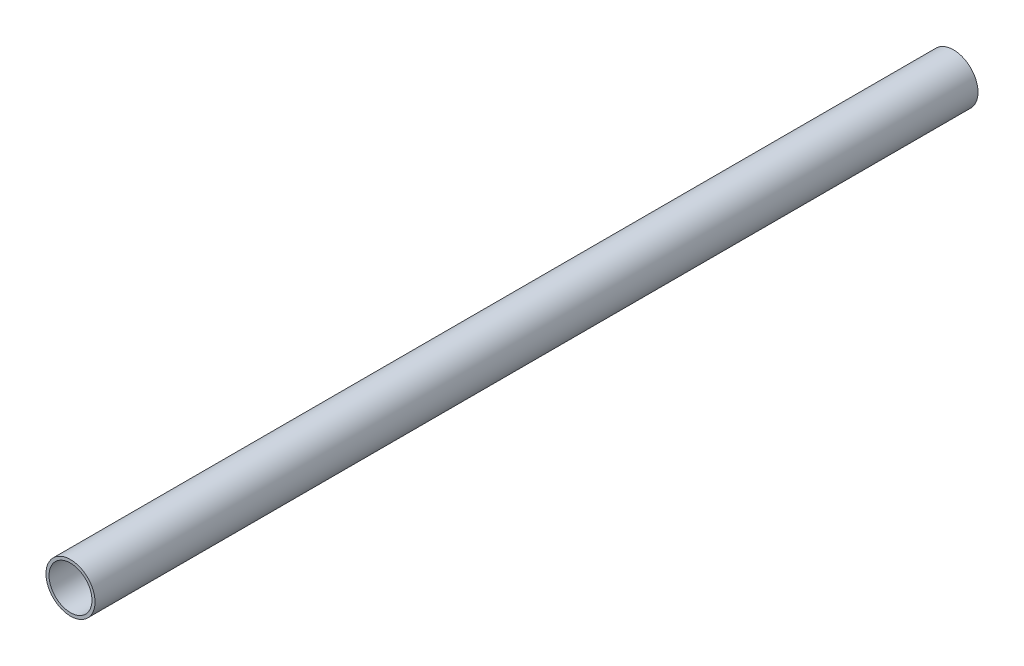
from build123d import *

# Parameters (mm, degrees)
SKETCH1_R           = 12.7
SKETCH1_R_2         = 11.1125
BOSS_EXTRUDE1_DEPTH = 457.2


with BuildPart() as part:
    # Sketch1 → Boss-Extrude1 (new body)
    with BuildSketch(Plane.XY):
        Circle(SKETCH1_R)
        Circle(SKETCH1_R_2, mode=Mode.SUBTRACT)
    extrude(amount=BOSS_EXTRUDE1_DEPTH)


solid = part.part
